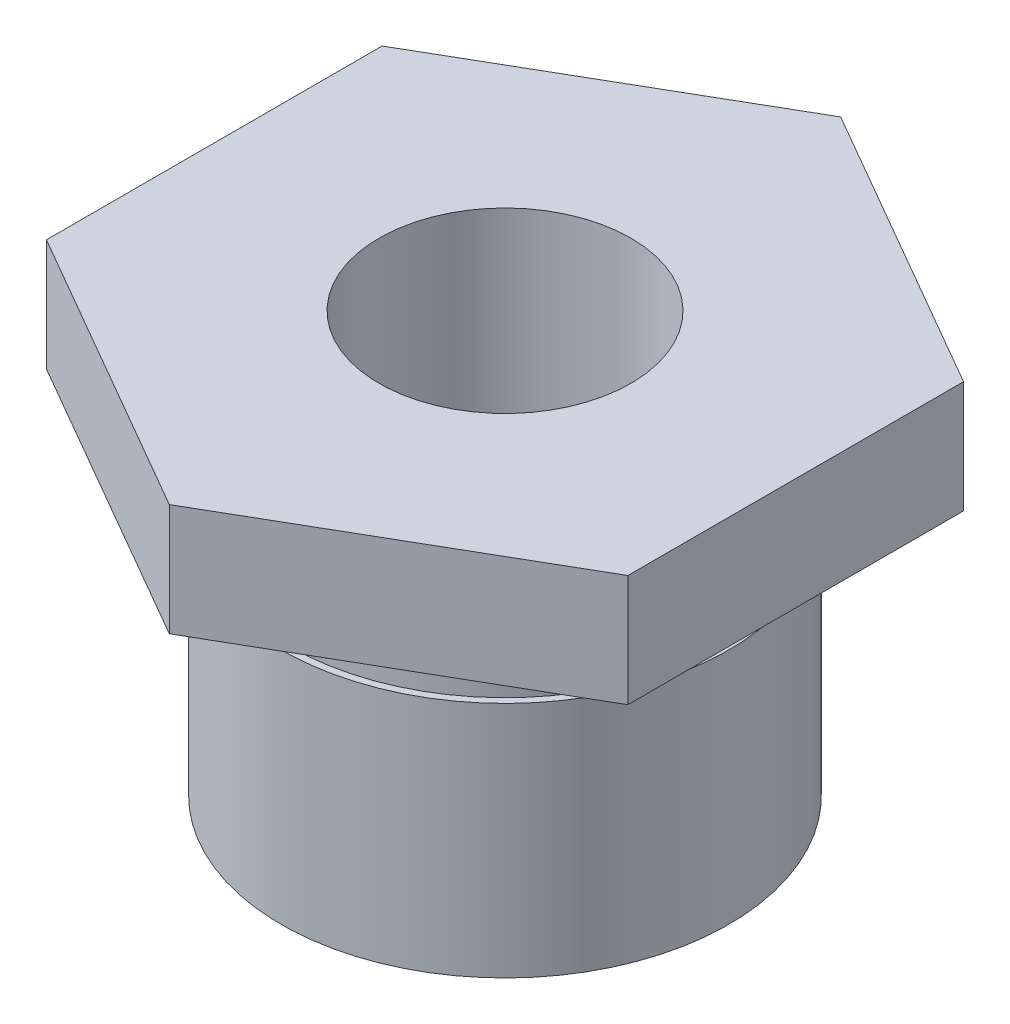
from build123d import *

# Parameters (mm, degrees)
SKETCH2_R          = 28.855655256
CUT_EXTRUDE1_DEPTH = 10


with BuildPart() as part:
    # Sketch1 → Revolve1 (revolve)
    with BuildSketch(Plane.XY, mode=Mode.PRIVATE) as revolve1_sk:
        Polygon((-9, 66.99759887), (-24, 66.99759887), (-24, 58.99759887), (-15.5, 58.99759887), (-15.5, 53.99759887), (-16, 53.99759887), (-16, 36.99759887), (-9, 36.99759887), align=None)
    revolve(revolve1_sk.sketch.rotate(Axis((0, 0, 0), (0, 1, 0)), 270), axis=Axis((0, 0, 0), (0, 1, 0)))

    # Sketch2 → Cut-Extrude1 (cut)
    with BuildSketch(Plane(origin=(0, 66.99759887, 0), x_dir=(-1, 0, 0), z_dir=(0, 1, 0))):
        Circle(SKETCH2_R)
        Polygon((0, -24), (20.784609691, -12), (20.784609691, 12), (0, 24), (-20.784609691, 12), (-20.784609691, -12), align=None, mode=Mode.SUBTRACT)
    extrude(amount=-CUT_EXTRUDE1_DEPTH, mode=Mode.SUBTRACT)


solid = part.part
